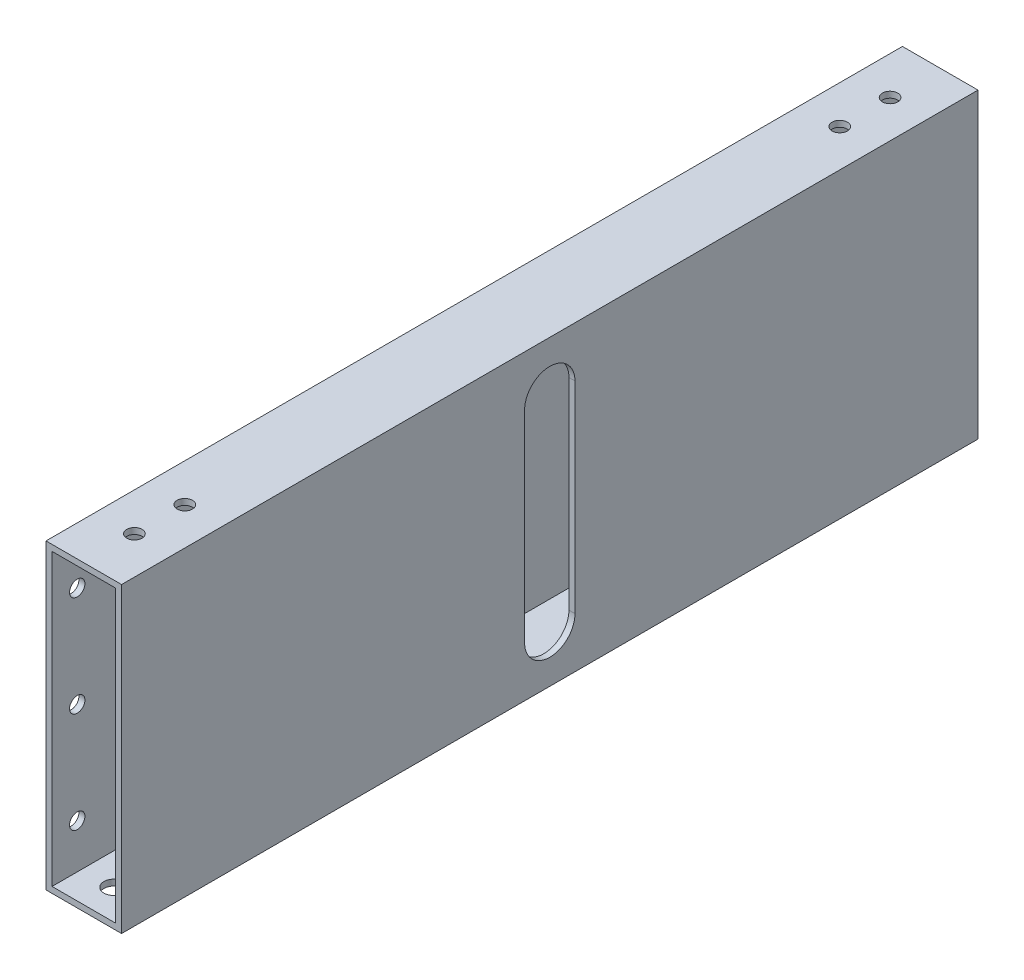
from build123d import *

# Parameters (mm, degrees)
SKETCH_1_W          = 15
SKETCH_1_H          = 60
SKETCH_1_W_2        = 12.6
SKETCH_1_H_2        = 57.6
EXTRUDE_1_DEPTH     = 85
SKETCH_2_R          = 2
CUT_EXTRUDE_1_DEPTH = 10
SKETCH_3_R          = 1.525
CUT_EXTRUDE_2_DEPTH = 10
SKETCH_4_R          = 1.525
CUT_EXTRUDE_3_DEPTH = 10
CUT_EXTRUDE_4_DEPTH = 10


with BuildPart() as part:
    # 草图1 → 凸台-拉伸1 (new, symmetric)
    with BuildSketch(Plane.XY):
        Rectangle(SKETCH_1_W, SKETCH_1_H)
        Rectangle(SKETCH_1_W_2, SKETCH_1_H_2, mode=Mode.SUBTRACT)
    extrude(amount=EXTRUDE_1_DEPTH, both=True)

    # 草图2 → 切除-拉伸1 (cut)
    with BuildSketch(Plane(origin=(0, -28.8, 0), x_dir=(1, 0, 0), z_dir=(0, 1, 0))):
        with Locations(Location((0, -79, 0), (0, 0, 270))):
            Circle(SKETCH_2_R)
        with Locations(Location((0, -61, 0), (0, 0, 270))):
            Circle(SKETCH_2_R)
    cut_extrude_1 = extrude(amount=-CUT_EXTRUDE_1_DEPTH, mode=Mode.SUBTRACT)

    # 镜向1: 切除-拉伸1 across plane
    add(cut_extrude_1.mirror(Plane.XY), mode=Mode.SUBTRACT)

    # 草图3 → 切除-拉伸2 (cut)
    with BuildSketch(Plane(origin=(0, 30, 0), x_dir=(1, 0, 0), z_dir=(0, 1, 0))):
        with Locations(Location((0.05, -75, 0), (0, 0, 270))):
            Circle(SKETCH_3_R)
        with Locations(Location((0.05, -65, 0), (0, 0, 270))):
            Circle(SKETCH_3_R)
        with Locations(Location((0.05, 65, 0), (0, 0, 90))):
            Circle(SKETCH_3_R)
        with Locations(Location((0.05, 75, 0), (0, 0, 90))):
            Circle(SKETCH_3_R)
    extrude(amount=-CUT_EXTRUDE_2_DEPTH, mode=Mode.SUBTRACT)

    # 草图4 → 切除-拉伸3 (cut)
    with BuildSketch(Plane(origin=(-6.3, 0, 0), x_dir=(0, 0, -1), z_dir=(1, 0, 0))):
        with Locations((0, -20)):
            Circle(SKETCH_4_R)
        Circle(SKETCH_4_R)
        with Locations((0, 20)):
            Circle(SKETCH_4_R)
        with Locations((-80, -20)):
            Circle(SKETCH_4_R)
        with Locations((-80, 0)):
            Circle(SKETCH_4_R)
        with Locations((-80, 20)):
            Circle(SKETCH_4_R)
        with Locations(Location((80, 20, 0), (0, 0, 90))):
            Circle(SKETCH_4_R)
        with Locations(Location((80, 0, 0), (0, 0, 90))):
            Circle(SKETCH_4_R)
        with Locations(Location((80, -20, 0), (0, 0, 90))):
            Circle(SKETCH_4_R)
    extrude(amount=-CUT_EXTRUDE_3_DEPTH, mode=Mode.SUBTRACT)

    # 草图5 → 切除-拉伸4 (cut)
    with BuildSketch(Plane(origin=(7.5, 0, 0), x_dir=(0, 0, -1), z_dir=(1, 0, 0))):
        with BuildLine():
            Line((-5, -20), (-5, 20))
            ThreePointArc((-5, 20), (0, 25), (5, 20))
            Line((5, 20), (5, -20))
            ThreePointArc((5, -20), (0, -25), (-5, -20))
        make_face()
    extrude(amount=-CUT_EXTRUDE_4_DEPTH, mode=Mode.SUBTRACT)


solid = part.part
